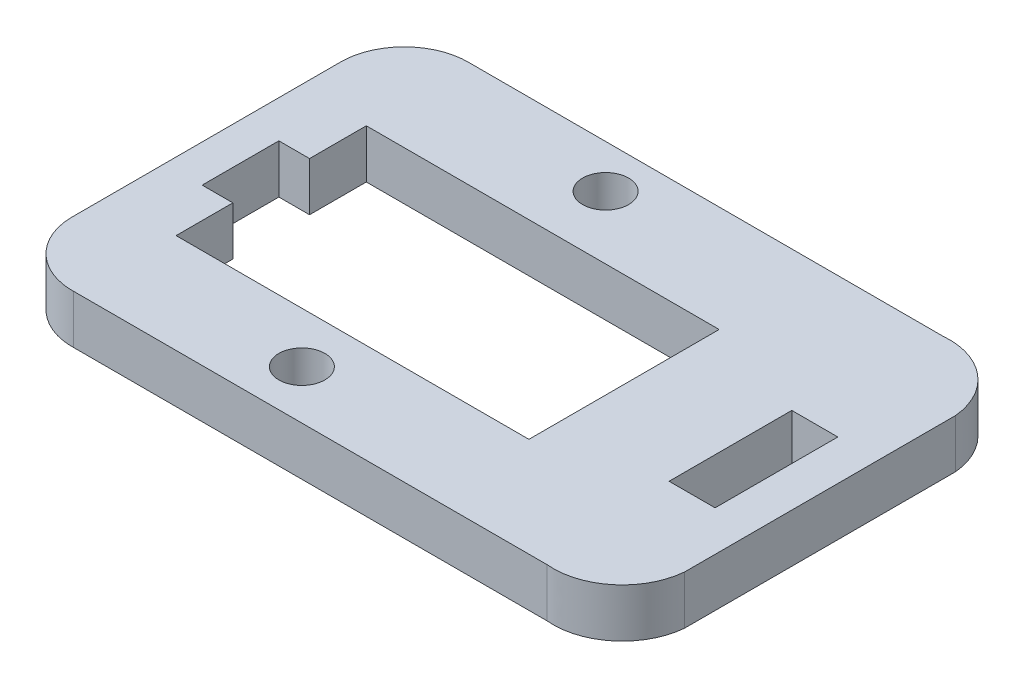
from build123d import *

# Parameters (mm, degrees)
SKETCH1_R           = 1.499950003
SKETCH1_R_2         = 1.49995001
SKETCH1_W           = 3.0001
SKETCH1_H           = 8
BOSS_EXTRUDE1_DEPTH = 3.175


with BuildPart() as part:
    # Sketch1 → Boss-Extrude1 (new body)
    with BuildSketch(Plane(origin=(0, 0, 0), x_dir=(1, 0, 0), z_dir=(0, 1, 0))):
        with BuildLine():
            Line((-15.7526, 12.89915), (15.1125, 12.89915))
            add(Edge.make_bspline(
                [(15.1125, 12.89915), (17.575103024, 13.12464748), (19.77450252, 11.294353024), (20, 8.83175)],
                knots=[0.111111111, 0.111111111, 0.111111111, 0.111111111, 0.222222222, 0.222222222, 0.222222222, 0.222222222], degree=3))
            Line((20, 8.83175), (20, -8.83175))
            add(Edge.make_bspline(
                [(20, -8.83175), (19.77450252, -11.294353024), (17.575103024, -13.12464748), (15.1125, -12.89915)],
                knots=[0.333333333, 0.333333333, 0.333333333, 0.333333333, 0.444444444, 0.444444444, 0.444444444, 0.444444444], degree=3))
            Line((15.1125, -12.89915), (-15.7526, -12.89915))
            add(Edge.make_bspline(
                [(-15.7526, -12.89915), (-18.039200664, -12.948650664), (-19.950499336, -11.118350664), (-20, -8.83175)],
                knots=[0.555555556, 0.555555556, 0.555555556, 0.555555556, 0.666666667, 0.666666667, 0.666666667, 0.666666667], degree=3))
            Line((-20, -8.83175), (-20, 8.83175))
            add(Edge.make_bspline(
                [(-20, 8.83175), (-19.950499336, 11.118350664), (-18.039200664, 12.948650664), (-15.7526, 12.89915)],
                knots=[0.777777778, 0.777777778, 0.777777778, 0.777777778, 1, 1, 1, 1], degree=3))
        make_face()
        with Locations(Location((-4.06191002, 10.083599991, 0), (0, 0, 270))):
            Circle(SKETCH1_R, mode=Mode.SUBTRACT)
        with Locations(Location((-4.06191002, -9.71635, 0), (0, 0, 270))):
            Circle(SKETCH1_R_2, mode=Mode.SUBTRACT)
        Polygon((-15.5612, 5.98375), (7.4388, 5.98375), (7.4388, -6.41625), (-15.5612, -6.41625), (-15.5612, -2.71635), (-17.5613, -2.71635), (-17.5613, 2.28365), (-15.5612, 2.28365), align=None, mode=Mode.SUBTRACT)
        with Locations((15.87435, -0.21635)):
            Rectangle(SKETCH1_W, SKETCH1_H, mode=Mode.SUBTRACT)
    extrude(amount=BOSS_EXTRUDE1_DEPTH)


solid = part.part
